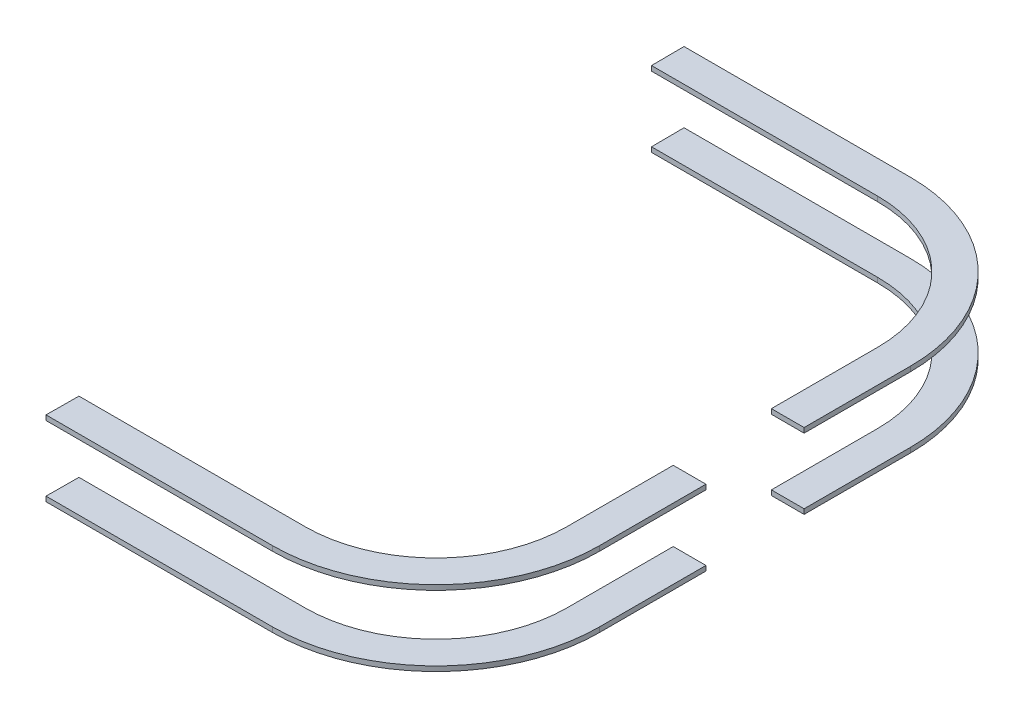
from build123d import *

# Parameters (mm, degrees)
BOSS_EXTRUDE1_DEPTH   = 3
BOSS_EXTRUDE1_2_DEPTH = 3
LPATTERN2_COUNT       = 2
LPATTERN2_PITCH       = 43


with BuildPart() as part:
    # Sketch1 → Boss-Extrude1 (new body)
    with BuildSketch(Plane(origin=(0, 0, 0), x_dir=(1, 0, 0), z_dir=(0, 1, 0))):
        with BuildLine():
            Line((0.072614511, 9.999736353), (100.072614511, 9.999736353))
            Line((100.072614511, 9.999736353), (138.327385489, 9.999736353))
            ThreePointArc((138.327385489, 9.999736353), (194.895927984, 33.431193858), (218.327385489, 89.999736353))
            Line((218.327385489, 89.999736353), (218.327385489, 95.000263647))
            Line((218.327385489, 95.000263647), (218.327385489, 155.000263647))
            Line((218.327385489, 155.000263647), (238.327385489, 155.000263647))
            Line((238.327385489, 155.000263647), (238.327385489, 95.000263647))
            Line((238.327385489, 95.000263647), (238.327385489, 90.000263647))
            ThreePointArc((238.327385489, 90.000263647), (209.038063608, 19.289585528), (138.327385489, -9.999736353))
            Line((138.327385489, -9.999736353), (99.927385489, -9.999736353))
            Line((99.927385489, -9.999736353), (-0.072614511, -9.999736353))
            Line((-0.072614511, -9.999736353), (0.072614511, 9.999736353))
        make_face()
    boss_extrude1 = extrude(amount=BOSS_EXTRUDE1_DEPTH)


with BuildPart() as body_2:
    # Sketch1 → Boss-Extrude1 2 (new body)
    with BuildSketch(Plane(origin=(0, 0, 0), x_dir=(1, 0, 0), z_dir=(0, 1, 0))):
        with BuildLine():
            Line((138.327385489, 380.000263647), (99.927385489, 380.000263647))
            Line((99.927385489, 380.000263647), (-0.072614511, 380.000263647))
            Line((-0.072614511, 380.000263647), (0.072614511, 360.00079094))
            Line((0.072614511, 360.00079094), (100.072614511, 360.00079094))
            Line((100.072614511, 360.00079094), (138.327385489, 360.00079094))
            ThreePointArc((138.327385489, 360.00079094), (194.895927984, 336.569333435), (218.327385489, 280.00079094))
            Line((218.327385489, 280.00079094), (218.327385489, 275.000263647))
            Line((218.327385489, 275.000263647), (218.327385489, 215.000263647))
            Line((218.327385489, 215.000263647), (238.327385489, 215.000263647))
            Line((238.327385489, 215.000263647), (238.327385489, 275.000263647))
            Line((238.327385489, 275.000263647), (238.327385489, 280.000263647))
            ThreePointArc((238.327385489, 280.000263647), (209.038063608, 350.710941765), (138.327385489, 380.000263647))
        make_face()
    boss_extrude1_2 = extrude(amount=BOSS_EXTRUDE1_2_DEPTH)


with BuildPart() as lpattern2_1:
    # LPattern2: Boss-Extrude1, Boss-Extrude1 2 ×2
    with Locations(*[(0, -i * LPATTERN2_PITCH, 0) for i in range(1, LPATTERN2_COUNT)]):
        add(boss_extrude1)
        add(boss_extrude1_2)


solid = Compound([part.part, body_2.part, lpattern2_1.part])
